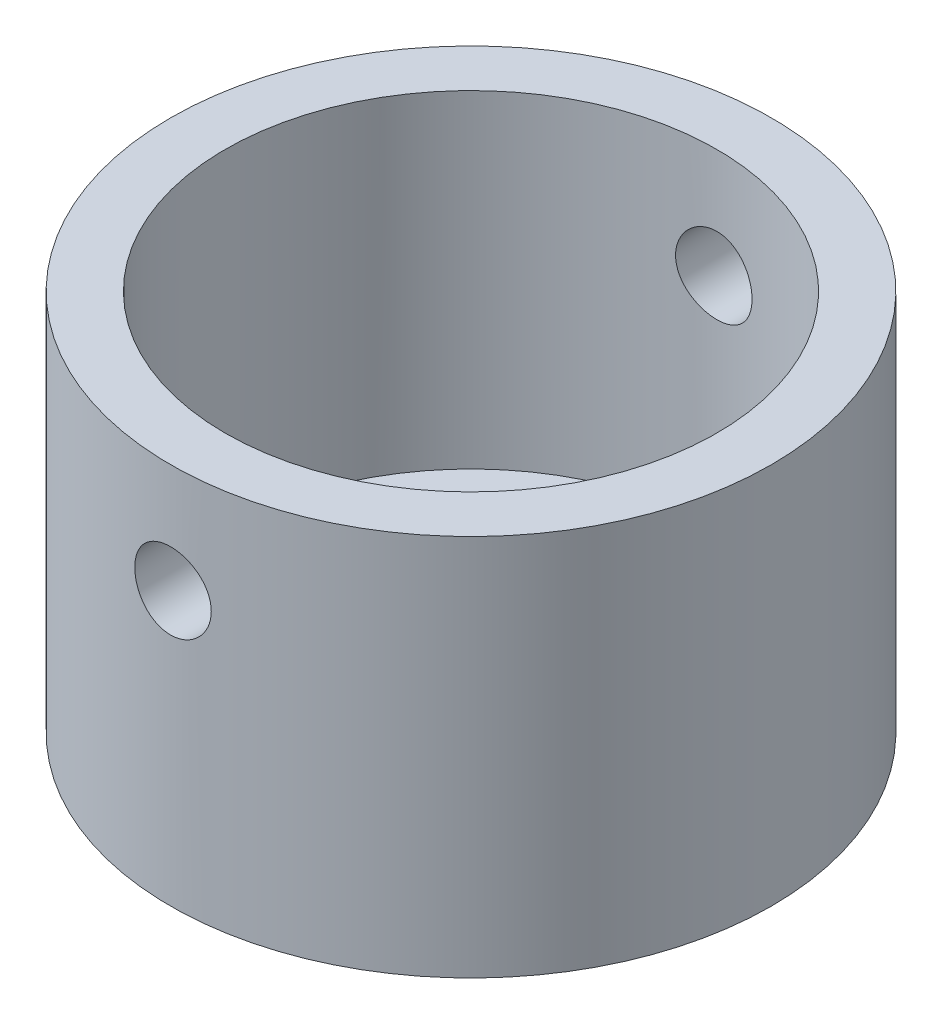
from build123d import *

# Parameters (mm, degrees)
EXTRUDE_THIN1_DEPTH      = 10
EXTRUDE_THIN1_DEPTH_BACK = 25
SKETCH1_R                = 27.5
SKETCH1_R_2              = 22.5
CUT_EXTRUDE1_REACH       = 68.38
CUT_EXTRUDE1_END_RADIUS  = 22.5
SKETCH2_R                = 3.5
BOSS_EXTRUDE1_START      = -5
SKETCH3_R                = 22.5
BOSS_EXTRUDE1_DEPTH      = 5


with BuildPart() as part:
    # Sketch1 → Extrude-Thin1 (new, two sides: drawn at the far end of the back side and taken through both)
    with BuildSketch(Plane(origin=(0, 0, 0), x_dir=(1, 0, 0), z_dir=(0, 1, 0)).offset(-EXTRUDE_THIN1_DEPTH_BACK)):
        Circle(SKETCH1_R)
        Circle(SKETCH1_R_2, mode=Mode.SUBTRACT)
    extrude(amount=EXTRUDE_THIN1_DEPTH + EXTRUDE_THIN1_DEPTH_BACK)

    # Cut-Extrude1: up to this cylinder (the profile starts outside it)
    cut_extrude1_end = Plane(origin=(0, 0, 0), z_dir=(0, 1, 0)) * Cylinder(CUT_EXTRUDE1_END_RADIUS, 182.76, mode=Mode.PRIVATE)
    # Sketch2 → Cut-Extrude1 (cut, up to the surface)
    with BuildSketch(Plane.XY.offset(27.5), mode=Mode.PRIVATE) as cut_extrude1_sk1:
        with Locations(Location((0, 0, 0), (0, 0, 270))):
            Circle(SKETCH2_R)
    cut_extrude1_tool1 = extrude(cut_extrude1_sk1.sketch, amount=-CUT_EXTRUDE1_REACH, mode=Mode.PRIVATE) - cut_extrude1_end
    cut_extrude1 = cut_extrude1_tool1.solids().sort_by_distance((0, 0, 27.5))[0]
    add(cut_extrude1, mode=Mode.SUBTRACT)

    # Mirror1: Cut-Extrude1 across plane
    add(cut_extrude1.mirror(Plane.XY), mode=Mode.SUBTRACT)

    # Sketch3 → Boss-Extrude1 (add)
    with BuildSketch(Plane.XZ.offset(25).offset(BOSS_EXTRUDE1_START)):
        with Locations(Location((0, 0, 0), (0, 0, 90))):
            Circle(SKETCH3_R)
    extrude(amount=BOSS_EXTRUDE1_DEPTH)


solid = part.part
